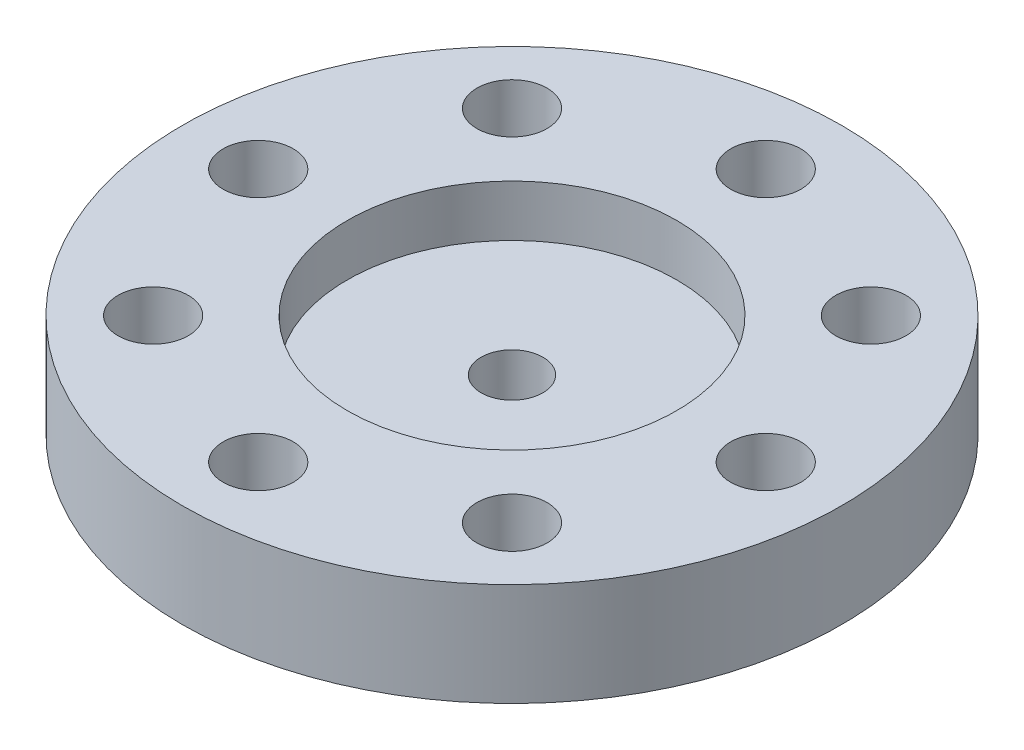
from build123d import *

# Parameters (mm, degrees)
F_6_32_TAPPED_HOLE1_D = 2.7051
CIRPATTERN1_COUNT     = 8


with BuildPart() as part:
    # Sketch1 → Revolve1 (revolve)
    with BuildSketch(Plane.XY, mode=Mode.PRIVATE) as revolve1_sk:
        Polygon((-12.7, 4.7625), (-12.7, 0.79375), (-1.190625, 0.79375), (-1.190625, 2.778125), (-6.35, 2.778125), (-6.35, 4.7625), align=None)
    revolve(revolve1_sk.sketch.rotate(Axis((0, 0, 0), (0, 1, 0)), 270), axis=Axis((0, 0, 0), (0, 1, 0)))

    # #6-32 Tapped Hole1 (through all)
    with Locations(Plane(origin=(0, 4.7625, 0), x_dir=(1, 0, 0), z_dir=(0, 1, 0))):
        with Locations((9.779, 0)):
            f_6_32_tapped_hole1 = Hole(F_6_32_TAPPED_HOLE1_D / 2)

    # CirPattern1: #6-32 Tapped Hole1 ×8 about axis
    cirpattern1_axis = Axis((0, 0, 0), (0, 1, 0))
    for i in range(1, CIRPATTERN1_COUNT):
        add(f_6_32_tapped_hole1.rotate(cirpattern1_axis, i * 360 / CIRPATTERN1_COUNT), mode=Mode.SUBTRACT)


solid = part.part
